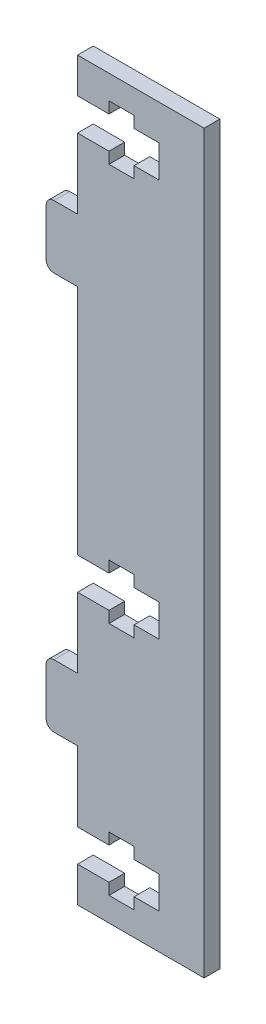
from build123d import *

# Parameters (mm, degrees)
EXTRUDE_1_DEPTH = 2
FILLET_1_R      = 1


with BuildPart() as part:
    # 草图1 → 凸台-拉伸1 (new body)
    with BuildSketch(Plane.XY):
        Polygon((0, 38.932825237), (4, 38.932825237), (4, 37.482825237), (7.2, 37.482825237), (7.2, 38.932825237), (10.4, 38.932825237), (10.4, 43.032825237), (7.2, 43.032825237), (7.2, 44.482825237), (4, 44.482825237), (4, 43.032825237), (0, 43.032825237), (0, 47.532825237), (16.125183107, 47.532825237), (16.125183107, -46.217174763), (0, -46.217174763), (0, -41.717174763), (4, -41.717174763), (4, -43.167174763), (7.2, -43.167174763), (7.2, -41.717174763), (10.4, -41.717174763), (10.4, -37.617174763), (7.2, -37.617174763), (7.2, -36.167174763), (4, -36.167174763), (4, -37.617174763), (0, -37.617174763), (0, -28.667174763), (-4, -28.667174763), (-4, -20.667174763), (0, -20.667174763), (0, -11.717174763), (4, -11.717174763), (4, -13.167174763), (7.2, -13.167174763), (7.2, -11.717174763), (10.4, -11.717174763), (10.4, -7.617174763), (7.2, -7.617174763), (7.2, -6.167174763), (4, -6.167174763), (4, -7.617174763), (0, -7.617174763), (0, 21.982825237), (-4, 21.982825237), (-4, 29.982825237), (0, 29.982825237), align=None)
    extrude(amount=EXTRUDE_1_DEPTH)

    # 圆角1
    fillet_1_edges = [part.edges().sort_by_distance(p)[0] for p in [
        (-4, 29.982825237, 1),
        (-4, 21.982825237, 1),
        (-4, -20.667174763, 1),
        (-4, -28.667174763, 1),
    ]]
    fillet(fillet_1_edges, radius=FILLET_1_R)


solid = part.part
